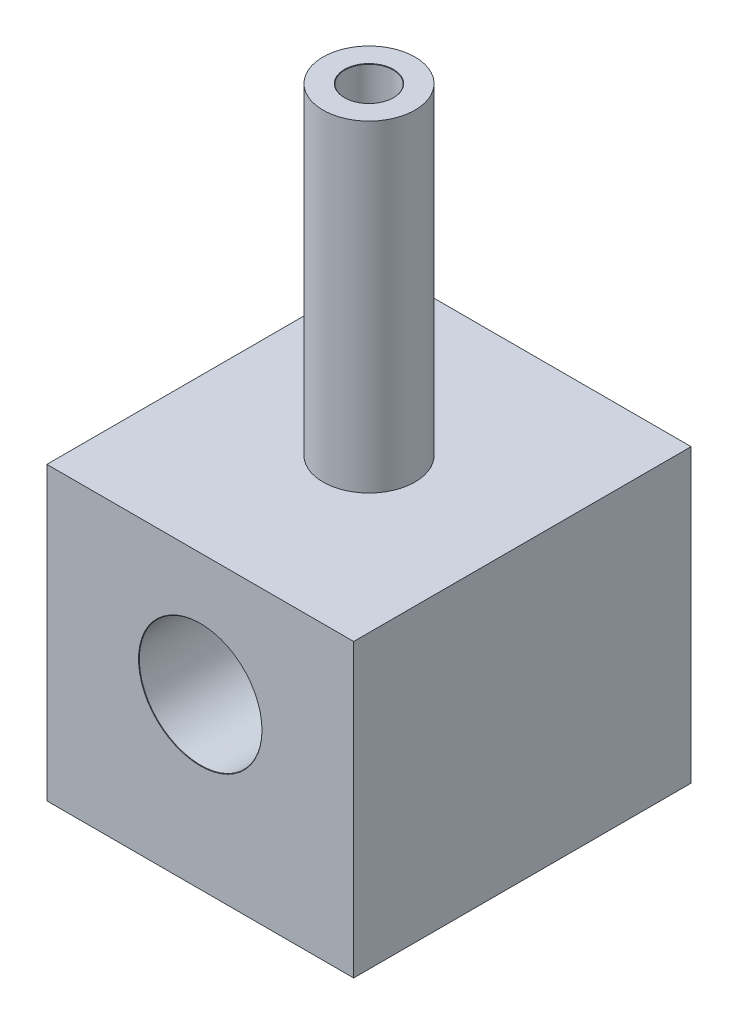
from build123d import *

# Parameters (mm, degrees)
SKETCH1_R                              = 10
BOSS_EXTRUDE1_DEPTH                    = 22
SKETCH6_R                              = 11
BOSS_EXTRUDE2_DEPTH                    = 11
F_8_0MM_DOWEL_HOLE1_D                  = 8
F_8_0MM_DOWEL_HOLE1_CSINK_D            = 8.05
F_8_0MM_DOWEL_HOLE1_CSINK_ANGLE        = 90
SKETCH9_R                              = 15.792919945
CUT_EXTRUDE1_DEPTH                     = 3
SKETCH8_R                              = 3
BOSS_EXTRUDE3_DEPTH                    = 21
SKETCH10_W                             = 4
SKETCH10_H                             = 22
BOSS_EXTRUDE4_DEPTH                    = 19
BOSS_EXTRUDE5_START                    = -3
BOSS_EXTRUDE5_DEPTH                    = 3
SKETCH12_W                             = 26
SKETCH12_H                             = 28
SKETCH12_W_2                           = 20
SKETCH12_H_2                           = 22
CUT_EXTRUDE2_DEPTH                     = 47.957427527
TAP_DRILL_FOR_M3_HELICOIL1_D           = 3.15
TAP_DRILL_FOR_M3_HELICOIL1_DEPTH       = 6
TAP_DRILL_FOR_M3_HELICOIL1_CSINK_D     = 3.2
TAP_DRILL_FOR_M3_HELICOIL1_CSINK_ANGLE = 90
TAP_DRILL_FOR_M3_HELICOIL1_TIP         = 0.946355475


with BuildPart() as part:
    # Sketch1 → Boss-Extrude1 (new body)
    with BuildSketch(Plane.XY):
        Circle(SKETCH1_R)
    extrude(amount=BOSS_EXTRUDE1_DEPTH)

    # Sketch6 → Boss-Extrude2 (add, symmetric)
    with BuildSketch(Plane(origin=(0, 0, 0), x_dir=(1, 0, 0), z_dir=(0, 1, 0))):
        with Locations(Location((0, -11, 0), (0, 0, 270))):
            Circle(SKETCH6_R)
    extrude(amount=BOSS_EXTRUDE2_DEPTH, both=True)

    # Ø8.0mm Dowel Hole1 (through all)
    with Locations(Plane.XY.offset(22)):
        with Locations((0, 0)):
            CounterSinkHole(F_8_0MM_DOWEL_HOLE1_D / 2, F_8_0MM_DOWEL_HOLE1_CSINK_D / 2, counter_sink_angle=F_8_0MM_DOWEL_HOLE1_CSINK_ANGLE)

    # Sketch9 → Cut-Extrude1 (cut)
    with BuildSketch(Plane(origin=(0, 11, 0), x_dir=(1, 0, 0), z_dir=(0, 1, 0))):
        with Locations((0, -11)):
            Circle(SKETCH9_R)
    extrude(amount=-CUT_EXTRUDE1_DEPTH, mode=Mode.SUBTRACT)

    # Sketch8 → Boss-Extrude3 (add)
    with BuildSketch(Plane(origin=(0, 8, 0), x_dir=(1, 0, 0), z_dir=(0, 1, 0))):
        with Locations(Location((0, -11, 0), (0, 0, 90))):
            Circle(SKETCH8_R)
    extrude(amount=BOSS_EXTRUDE3_DEPTH)

    # Sketch10 → Boss-Extrude4 (add)
    with BuildSketch(Plane(origin=(0, 8, 0), x_dir=(1, 0, 0), z_dir=(0, 1, 0))):
        with Locations((-8, -11)):
            Rectangle(SKETCH10_W, SKETCH10_H)
        with Locations((8, -11)):
            Rectangle(SKETCH10_W, SKETCH10_H)
    extrude(amount=-BOSS_EXTRUDE4_DEPTH)

    # Sketch11 → Boss-Extrude5 (add)
    with BuildSketch(Plane.XZ.offset(11).offset(BOSS_EXTRUDE5_START)):
        with BuildLine():
            Line((0, 22), (-6, 22))
            Line((-6, 22), (-6, 20.219544457))
            ThreePointArc((-6, 20.219544457), (-3.129297922, 21.545496409), (0, 22))
        make_face()
        with BuildLine():
            Line((6, 22), (0, 22))
            ThreePointArc((0, 22), (3.129297922, 21.545496409), (6, 20.219544457))
            Line((6, 20.219544457), (6, 22))
        make_face()
        with BuildLine():
            Line((-6, 1.780455543), (-6, 0))
            Line((-6, 0), (-1.12e-07, 0))
            ThreePointArc((-1.12e-07, 0), (-3.129297976, 0.454503607), (-6, 1.780455543))
        make_face()
        with BuildLine():
            ThreePointArc((6, 1.780455543), (3.129297868, 0.454503575), (-1.12e-07, 0))
            Line((-1.12e-07, 0), (6, 0))
            Line((6, 0), (6, 1.780455543))
        make_face()
    extrude(amount=BOSS_EXTRUDE5_DEPTH)

    # Sketch12 → Cut-Extrude2 (cut, through all)
    with BuildSketch(Plane.XZ.offset(11)):
        with Locations((0, 11)):
            Rectangle(SKETCH12_W, SKETCH12_H)
        with Locations((0, 11)):
            Rectangle(SKETCH12_W_2, SKETCH12_H_2, mode=Mode.SUBTRACT)
    extrude(amount=-CUT_EXTRUDE2_DEPTH, mode=Mode.SUBTRACT)

    # Tap Drill for M3 Helicoil1
    with Locations(Plane(origin=(0, 29, 0), x_dir=(1, 0, 0), z_dir=(0, 1, 0))):
        with Locations((0, -11)):
            CounterSinkHole(TAP_DRILL_FOR_M3_HELICOIL1_D / 2, TAP_DRILL_FOR_M3_HELICOIL1_CSINK_D / 2, depth=TAP_DRILL_FOR_M3_HELICOIL1_DEPTH, counter_sink_angle=TAP_DRILL_FOR_M3_HELICOIL1_CSINK_ANGLE)
            with Locations((0, 0, -(TAP_DRILL_FOR_M3_HELICOIL1_DEPTH + TAP_DRILL_FOR_M3_HELICOIL1_TIP / 2))):  # 118° drill point
                Cone(0, TAP_DRILL_FOR_M3_HELICOIL1_D / 2, TAP_DRILL_FOR_M3_HELICOIL1_TIP, mode=Mode.SUBTRACT)


solid = part.part
